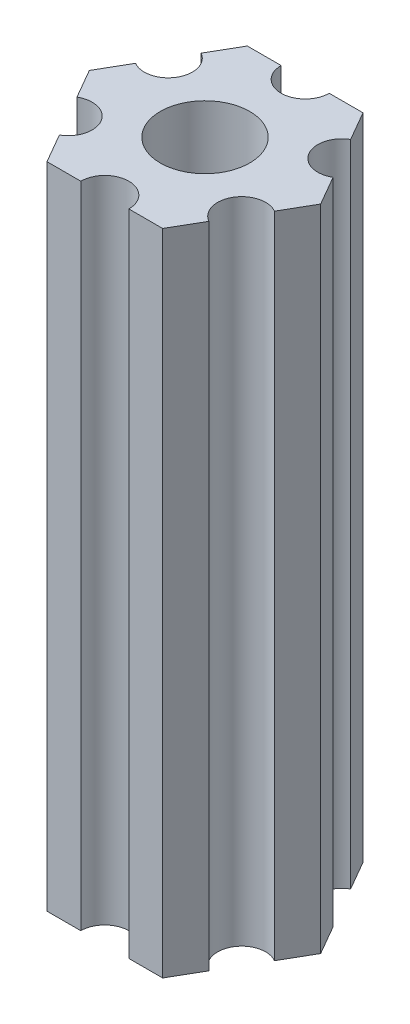
from build123d import *

# Parameters (mm, degrees)
ESBO_O1_R                = 2.79
RESSALTO_EXTRUS_O1_DEPTH = 40.5


with BuildPart() as part:
    # Esboço1 → Ressalto-extrusão1 (new body)
    with BuildSketch(Plane.XZ.offset(34.5)):
        with BuildLine():
            Line((77.062658774, 17.174038106), (78.116878365, 19))
            Line((78.116878365, 19), (77.062658774, 20.825961894))
            ThreePointArc((77.062658774, 20.825961894), (75.013620668, 21.375), (75.562658774, 23.424038106))
            Line((75.562658774, 23.424038106), (74.508439182, 25.25))
            Line((74.508439182, 25.25), (72.4, 25.25))
            ThreePointArc((72.4, 25.25), (70.9, 23.75), (69.4, 25.25))
            Line((69.4, 25.25), (67.291560818, 25.25))
            Line((67.291560818, 25.25), (66.237341226, 23.424038106))
            ThreePointArc((66.237341226, 23.424038106), (66.786379332, 21.375), (64.737341226, 20.825961894))
            Line((64.737341226, 20.825961894), (63.683121635, 19))
            Line((63.683121635, 19), (64.737341226, 17.174038106))
            ThreePointArc((64.737341226, 17.174038106), (66.786379332, 16.625), (66.237341226, 14.575961894))
            Line((66.237341226, 14.575961894), (67.291560818, 12.75))
            Line((67.291560818, 12.75), (69.4, 12.75))
            ThreePointArc((69.4, 12.75), (70.9, 14.25), (72.4, 12.75))
            Line((72.4, 12.75), (74.508439182, 12.75))
            Line((74.508439182, 12.75), (75.562658774, 14.575961894))
            ThreePointArc((75.562658774, 14.575961894), (75.013620668, 16.625), (77.062658774, 17.174038106))
        make_face()
        with Locations(Location((70.9, 19, 0), (0, 0, 90))):
            Circle(ESBO_O1_R, mode=Mode.SUBTRACT)
    extrude(amount=-RESSALTO_EXTRUS_O1_DEPTH)


solid = part.part
